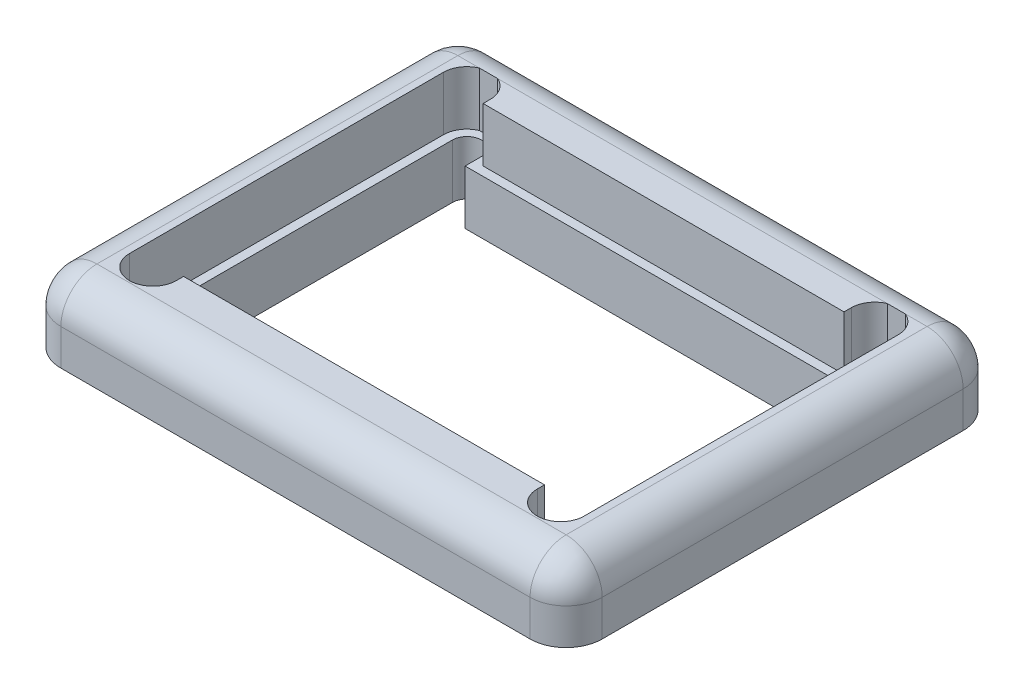
from build123d import *

# Parameters (mm, degrees)
SKETCH2_W           = 150
SKETCH2_H           = 120
BOSS_EXTRUDE1_DEPTH = 20
FILLET1_R           = 10
BOSS_EXTRUDE2_DEPTH = 10
CUT_EXTRUDE1_DEPTH  = 30
CUT_EXTRUDE2_DEPTH  = 15


with BuildPart() as part:
    # Sketch2 → Boss-Extrude1 (new body)
    with BuildSketch(Plane(origin=(0, 0, 0), x_dir=(1, 0, 0), z_dir=(0, 1, 0))):
        Rectangle(SKETCH2_W, SKETCH2_H)
    extrude(amount=BOSS_EXTRUDE1_DEPTH)

    # Fillet1
    fillet1_edges = [part.edges().sort_by_distance(p)[0] for p in [
        (-75, 20, 0),
        (0, 20, 60),
        (75, 20, 0),
        (75, 10, 60),
        (-75, 10, 60),
        (-75, 10, -60),
        (75, 10, -60),
        (0, 20, -60),
    ]]
    fillet(fillet1_edges, radius=FILLET1_R)

    # Sketch3 → Boss-Extrude2 (add)
    with BuildSketch(Plane.XZ):
        with BuildLine():
            ThreePointArc((-64.75, 39.75), (-61.821067812, 46.821067812), (-54.75, 49.75))
            Line((-54.75, 49.75), (54.75, 49.75))
            ThreePointArc((54.75, 49.75), (61.821067812, 46.821067812), (64.75, 39.75))
            Line((64.75, 39.75), (64.75, -39.75))
            ThreePointArc((64.75, -39.75), (61.821067812, -46.821067812), (54.75, -49.75))
            Line((54.75, -49.75), (-54.75, -49.75))
            ThreePointArc((-54.75, -49.75), (-61.821067812, -46.821067812), (-64.75, -39.75))
            Line((-64.75, -39.75), (-64.75, 39.75))
        make_face()
    extrude(amount=BOSS_EXTRUDE2_DEPTH)

    # Sketch4 → Cut-Extrude1 (cut)
    with BuildSketch(Plane(origin=(0, 20, 0), x_dir=(1, 0, 0), z_dir=(0, 1, 0))):
        with BuildLine():
            Line((52.5, -38.5), (52.5, -43))
            ThreePointArc((52.5, -43), (56.5, -47), (60.5, -43))
            Line((60.5, -43), (60.5, 44))
            ThreePointArc((60.5, 44), (56.5, 48), (52.5, 44))
            Line((52.5, 44), (52.5, 39.5))
            Line((52.5, 39.5), (-52.5, 39.5))
            Line((-52.5, 39.5), (-52.5, 44))
            ThreePointArc((-52.5, 44), (-56.5, 48), (-60.5, 44))
            Line((-60.5, 44), (-60.5, -43.000001))
            ThreePointArc((-60.5, -43.000001), (-56.5, -47.000001), (-52.5, -43.000001))
            Line((-52.5, -43.000001), (-52.5, -38.5))
            Line((-52.5, -38.5), (52.5, -38.5))
        make_face()
    extrude(amount=-CUT_EXTRUDE1_DEPTH, mode=Mode.SUBTRACT)

    # Sketch4<3> → Cut-Extrude2 (cut)
    with BuildSketch(Plane(origin=(0, 20, 0), x_dir=(1, 0, 0), z_dir=(0, 1, 0))):
        with BuildLine():
            Line((-50, -43.000001), (-50, -41))
            Line((-50, -41), (50, -41))
            Line((50, -41), (50, -43))
            ThreePointArc((50, -43), (56.5, -49.5), (63, -43))
            Line((63, -43), (63, 44))
            ThreePointArc((63, 44), (61.908326913, 47.605551275), (59, 50))
            Line((59, 50), (54, 50))
            ThreePointArc((54, 50), (51.091673087, 47.605551275), (50, 44))
            Line((50, 44), (50, 42))
            Line((50, 42), (-50, 42))
            Line((-50, 42), (-50, 44))
            ThreePointArc((-50, 44), (-51.091673087, 47.605551275), (-54, 50))
            Line((-54, 50), (-59, 50))
            ThreePointArc((-59, 50), (-61.908326913, 47.605551275), (-63, 44))
            Line((-63, 44), (-63, -43.000001))
            ThreePointArc((-63, -43.000001), (-56.5, -49.500001), (-50, -43.000001))
        make_face()
        with BuildLine():
            Line((52.5, 39.5), (52.5, 44))
            ThreePointArc((52.5, 44), (56.5, 48), (60.5, 44))
            Line((60.5, 44), (60.5, -43))
            ThreePointArc((60.5, -43), (56.5, -47), (52.5, -43))
            Line((52.5, -43), (52.5, -38.5))
            Line((52.5, -38.5), (-52.5, -38.5))
            Line((-52.5, -38.5), (-52.5, -43.000001))
            ThreePointArc((-52.5, -43.000001), (-56.5, -47.000001), (-60.5, -43.000001))
            Line((-60.5, -43.000001), (-60.5, 44))
            ThreePointArc((-60.5, 44), (-56.5, 48), (-52.5, 44))
            Line((-52.5, 44), (-52.5, 39.5))
            Line((-52.5, 39.5), (52.5, 39.5))
        make_face(mode=Mode.SUBTRACT)
    extrude(amount=-CUT_EXTRUDE2_DEPTH, mode=Mode.SUBTRACT)


solid = part.part
